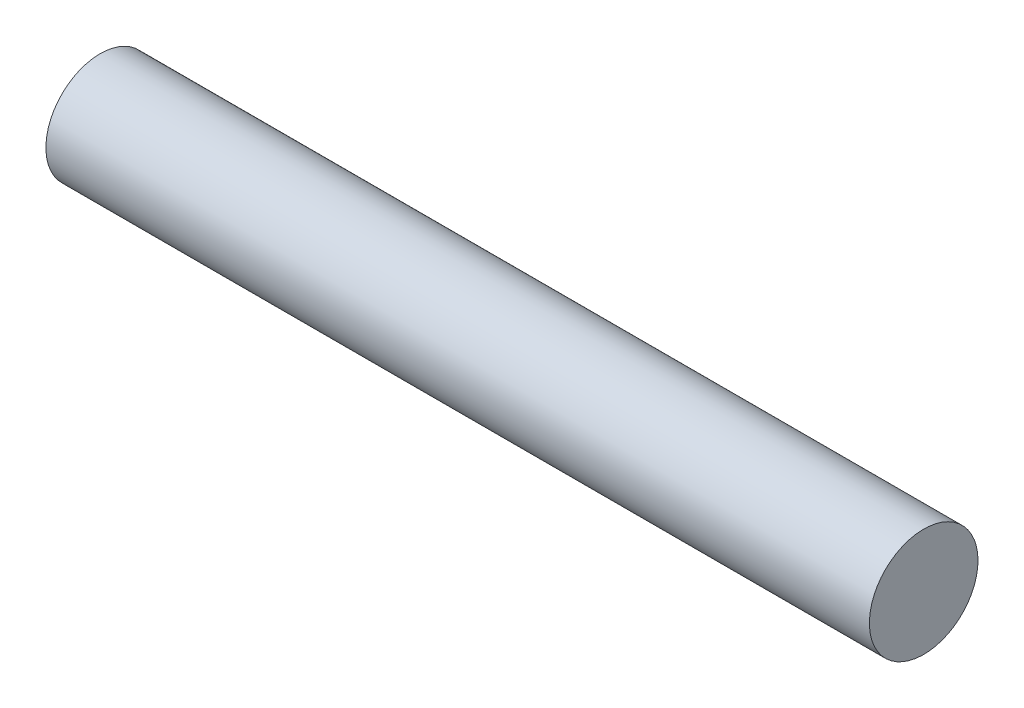
from build123d import *

# Parameters (mm, degrees)
IZIM1_R                     = 6
Y_KSEKLIK_EKSTR_ZYON1_DEPTH = 91


with BuildPart() as part:
    # Çizim1 → Yükseklik-Ekstrüzyon1 (new body)
    with BuildSketch(Plane(origin=(0, 0, 0), x_dir=(0, 0, -1), z_dir=(1, 0, 0))):
        Circle(IZIM1_R)
    extrude(amount=Y_KSEKLIK_EKSTR_ZYON1_DEPTH)


solid = part.part
